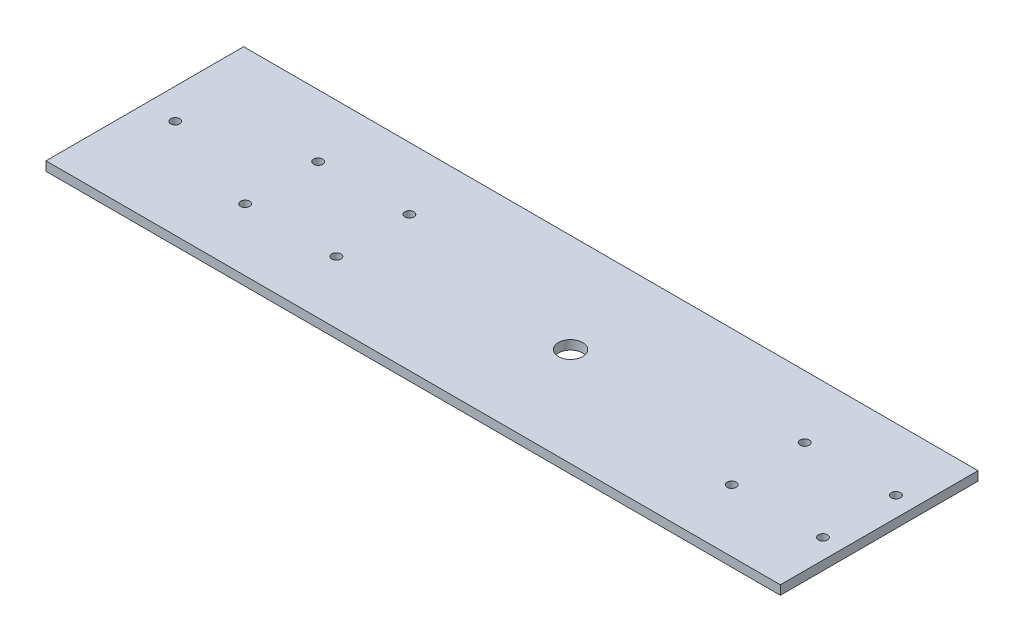
from build123d import *

# Parameters (mm, degrees)
SKETCH1_W               = 241.5
SKETCH1_H               = 65
BOSS_EXTRUDE1_DEPTH     = 1.5
SKETCH3_R               = 4
CUT_EXTRUDE2_DEPTH      = 144.754130375
SKETCH4_R               = 1.5
CUT_EXTRUDE3_DEPTH      = 144.754130375
CUT_EXTRUDE4_DEPTH      = 144.754130375
CUT_EXTRUDE4_DEPTH_BACK = 144.754130375
SKETCH5_R               = 1.5


with BuildPart() as part:
    # Sketch1 → Boss-Extrude1 (new, symmetric)
    with BuildSketch(Plane(origin=(0, 0, 0), x_dir=(1, 0, 0), z_dir=(0, 1, 0))):
        with Locations((-19.25, 0)):
            Rectangle(SKETCH1_W, SKETCH1_H)
    extrude(amount=BOSS_EXTRUDE1_DEPTH, both=True)

    # Sketch3 → Cut-Extrude2 (cut, through all)
    with BuildSketch(Plane(origin=(0, 1.5, 0), x_dir=(1, 0, 0), z_dir=(0, 1, 0))):
        with Locations(Location((0, 0, 0), (0, 0, 270))):
            Circle(SKETCH3_R)
    extrude(amount=-CUT_EXTRUDE2_DEPTH, mode=Mode.SUBTRACT)

    # Sketch4 → Cut-Extrude3 (cut, symmetric)
    with BuildSketch(Plane(origin=(0, 1.5, 0), x_dir=(1, 0, 0), z_dir=(0, 1, 0))):
        with Locations(Location((65, 12, 0), (0, 0, 270))):
            Circle(SKETCH4_R)
        with Locations(Location((95, 12, 0), (0, 0, 270))):
            Circle(SKETCH4_R)
        with Locations(Location((95, -12, 0), (0, 0, 90))):
            Circle(SKETCH4_R)
        with Locations(Location((65, -12, 0), (0, 0, 90))):
            Circle(SKETCH4_R)
    cut_extrude3 = extrude(amount=CUT_EXTRUDE3_DEPTH, both=True, mode=Mode.SUBTRACT)

    # Mirror2: Cut-Extrude3 across plane
    add(cut_extrude3.mirror(Plane(origin=(0, 0, 0), x_dir=(0, 0, 1), z_dir=(1, 0, 0))), mode=Mode.SUBTRACT)

    # Sketch5 → Cut-Extrude4 (cut, two sides: drawn at the far end of the back side and taken through both)
    with BuildSketch(Plane(origin=(0, 1.5, 0), x_dir=(1, 0, 0), z_dir=(0, 1, 0)).offset(-CUT_EXTRUDE4_DEPTH_BACK)):
        with Locations(Location((-130, 0, 0), (0, 0, 270))):
            Circle(SKETCH5_R)
    extrude(amount=CUT_EXTRUDE4_DEPTH + CUT_EXTRUDE4_DEPTH_BACK, mode=Mode.SUBTRACT)


solid = part.part
